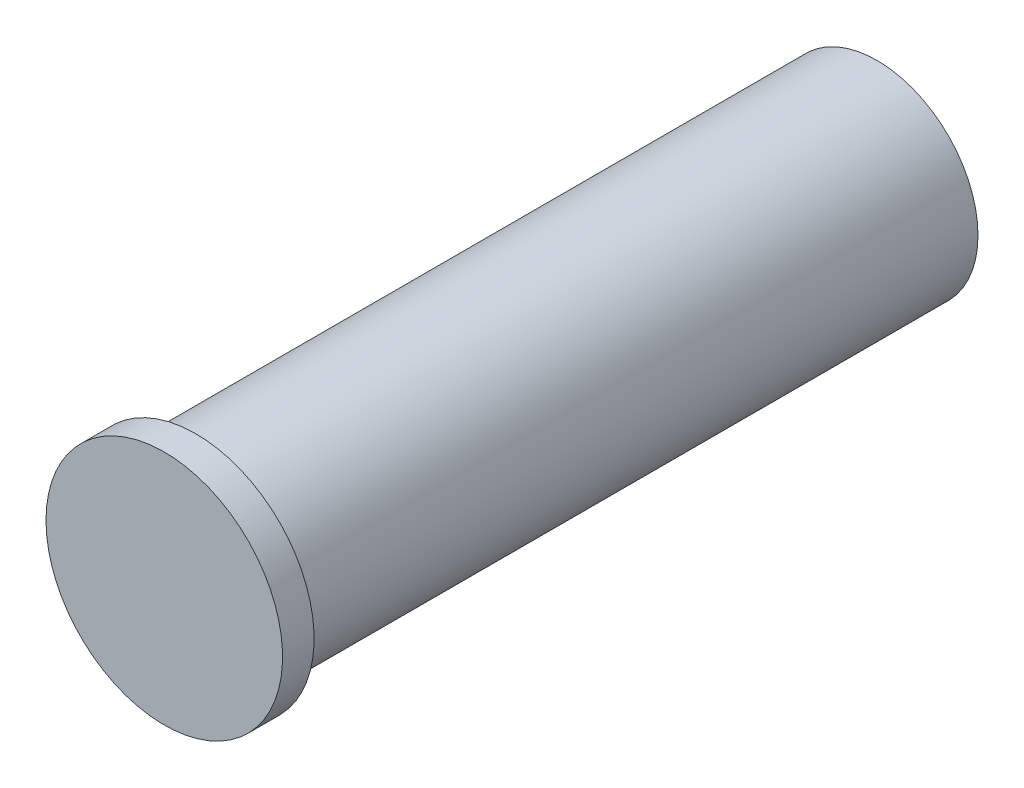
from build123d import *

# Parameters (mm, degrees)
SKETCH1_R           = 3.048
SKETCH1_R_2         = 1.4605
BOSS_EXTRUDE1_DEPTH = 20.574
SKETCH2_R           = 3.571875
BOSS_EXTRUDE2_DEPTH = 0.9525


with BuildPart() as part:
    # Sketch1 → Boss-Extrude1 (new body)
    with BuildSketch(Plane.XY):
        Circle(SKETCH1_R)
        Circle(SKETCH1_R_2, mode=Mode.SUBTRACT)
    extrude(amount=BOSS_EXTRUDE1_DEPTH)

    # Sketch2 → Boss-Extrude2 (add)
    with BuildSketch(Plane.XY.offset(20.574)):
        with Locations(Location((0, 0, 0), (0, 0, 180))):
            Circle(SKETCH2_R)
    extrude(amount=BOSS_EXTRUDE2_DEPTH)


solid = part.part
